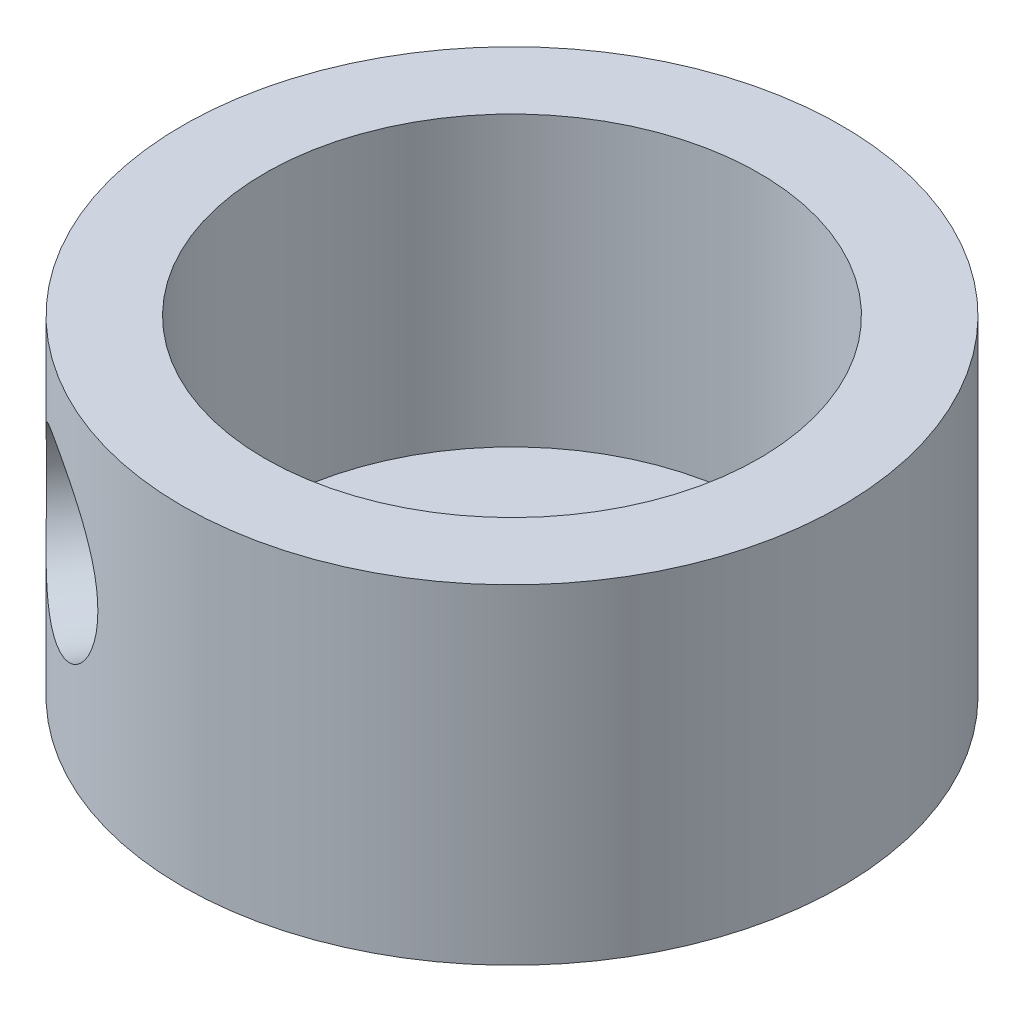
from build123d import *

# Parameters (mm, degrees)
SKETCH_1_R                   = 40
EXTRUDE_1_DEPTH              = 40
SKETCH_3_R                   = 30
CUT_EXTRUDE_2_DEPTH          = 35
HOLE_WIZARD_21_0_21_1_REACH  = 100.524
HOLE_WIZARD_21_0_21_1_BORE_R = 10.5


with BuildPart() as part:
    # 草圖1 → 填料-伸長1 (new body)
    with BuildSketch(Plane(origin=(0, 0, 0), x_dir=(1, 0, 0), z_dir=(0, 1, 0))):
        with Locations(Location((0, 0, 0), (0, 0, 270))):
            Circle(SKETCH_1_R)
    extrude(amount=EXTRUDE_1_DEPTH)

    # 草圖3 → 除料-伸長2 (cut)
    with BuildSketch(Plane(origin=(0, 40, 0), x_dir=(1, 0, 0), z_dir=(0, 1, 0))):
        with Locations(Location((0, 0, 0), (0, 0, 270))):
            Circle(SKETCH_3_R)
    extrude(amount=-CUT_EXTRUDE_2_DEPTH, mode=Mode.SUBTRACT)

    # Ø21.0 (21) 直徑孔1 bore (on position points) → Ø21.0 (21) 直徑孔1 (cut, up to next)
    with BuildSketch(Plane(origin=(-21.744758151, 21.94181737, 33.573285406), x_dir=(0.839332135156, 0, 0.543618953768), z_dir=(-0.543618953768, 0, 0.839332135156)), mode=Mode.PRIVATE) as hole_wizard_21_0_21_1_sk1:
        Circle(HOLE_WIZARD_21_0_21_1_BORE_R)
    hole_wizard_21_0_21_1_tool1 = extrude(hole_wizard_21_0_21_1_sk1.sketch, amount=-HOLE_WIZARD_21_0_21_1_REACH, mode=Mode.PRIVATE) & part.part
    add(hole_wizard_21_0_21_1_tool1.solids().sort_by_distance((-21.744758, 21.941817, 33.573285))[0], mode=Mode.SUBTRACT)


solid = part.part
